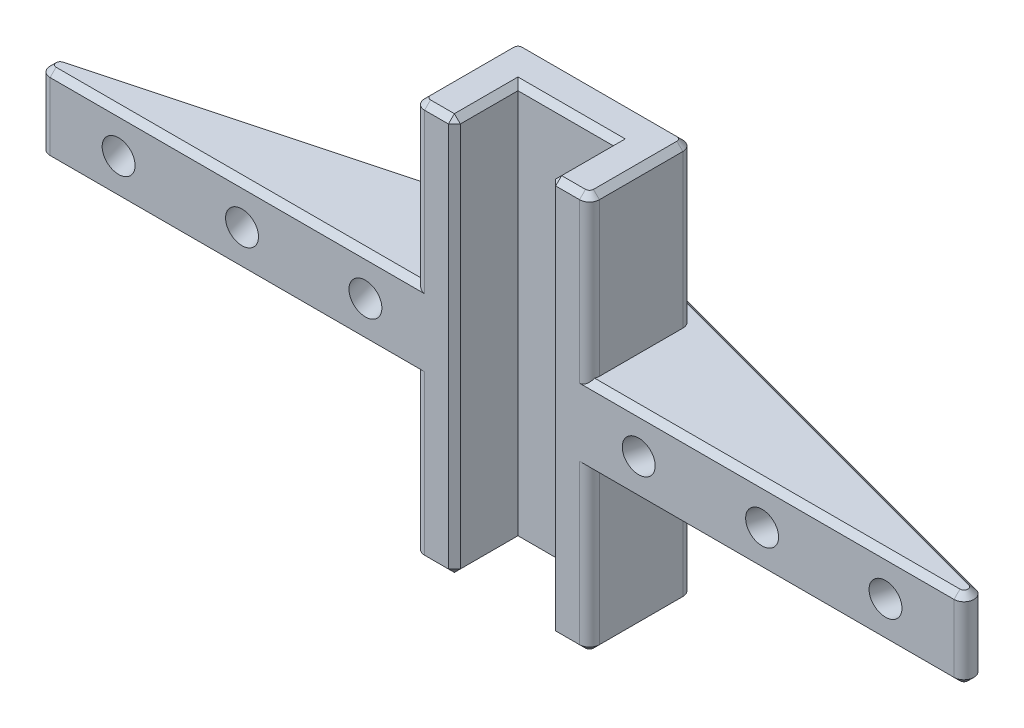
from build123d import *
from OCP.BRepFilletAPI import BRepFilletAPI_MakeChamfer

# Parameters (mm, degrees)
BOSS_EXTRUDE1_DEPTH            = 10
BOSS_EXTRUDE2_DEPTH            = 50
F_8_0MM_DOWEL_HOLE1_D          = 8
FILLET1_R                      = 2.5
CHAMFER1_SIZE                  = 1.5
CBORE_FOR_M5_SHCS1_D           = 5.5
CBORE_FOR_M5_SHCS1_CBORE_D     = 10
CBORE_FOR_M5_SHCS1_CBORE_DEPTH = 5
SKETCH9_R                      = 2.75
BOSS_EXTRUDE3_DEPTH            = 0.4
CHAMFER2_SIZE                  = 1
CHAMFER2_SIZE2                 = 1.732050808


with BuildPart() as part:
    # Sketch1 → Boss-Extrude1 (new, symmetric)
    with BuildSketch(Plane(origin=(0, 0, 0), x_dir=(1, 0, 0), z_dir=(0, 1, 0))):
        Polygon((12, 0), (-12, 0), (-12, -16), (-132.740728286, -16), (-12, 16.352380638), (12, 16.352380638), (132.740728286, -16), (12, -16), align=None)
    extrude(amount=BOSS_EXTRUDE1_DEPTH, both=True)

    # Sketch2 → Boss-Extrude2 (add, symmetric)
    with BuildSketch(Plane(origin=(0, 0, 0), x_dir=(1, 0, 0), z_dir=(0, 1, 0))):
        Polygon((-12, -16), (-12, 0), (12, 0), (12, -16), (22, -16), (22, 10), (-22, 10), (-22, -16), align=None)
    extrude(amount=BOSS_EXTRUDE2_DEPTH, both=True)

    # Ø8.0mm Dowel Hole1 (through all)
    with Locations(Plane(origin=(4.891942737, 0, -18.256978841), x_dir=(-0.96592582628907, 0, -0.2588190451025143), z_dir=(0.2588190451025143, 0, -0.96592582628907))):
        with Locations((-97.358802374, 0), (-67.358802374, 0), (-37.358802374, 0)):
            f_8_0mm_dowel_hole1 = Hole(F_8_0MM_DOWEL_HOLE1_D / 2)

    # Mirror1: Ø8.0mm Dowel Hole1 across plane
    add(f_8_0mm_dowel_hole1.mirror(Plane(origin=(0, 0, 0), x_dir=(0, 0, 1), z_dir=(1, 0, 0))), mode=Mode.SUBTRACT)

    # Fillet1
    fillet1_edges = [part.edges().sort_by_distance(p)[0] for p in [
        (-132.740728286, 0, 16),
        (-12, 0, -16.352380638),
        (12, 0, -16.352380638),
        (132.740728286, 0, 16),
        (-22, 30, 16),
        (22, 30, 16),
        (22, 30, -10),
        (-22, 30, -10),
        (-22, -30, 16),
        (22, -30, 16),
        (22, -30, -10),
        (-22, -30, -10),
    ]]
    fillet(fillet1_edges, radius=FILLET1_R)

    # Chamfer1
    chamfer1_edges = [part.edges().sort_by_distance(p)[0] for p in [
        (0, 10, -16.352380638),
        (-66.625671502, -10, 16),
        (-63.358153493, -10, -2.591004885),
        (63.358153493, -10, -2.591004885),
        (-116.229955158, -10, 13.826315481),
        (116.229955158, -10, 13.826315481),
        (-11.997184237, -10, -16.330992791),
        (11.997184237, -10, -16.330992791),
        (63.358153493, 10, -2.591004885),
        (-63.358153493, 10, -2.591004885),
        (-66.625671502, 10, 16),
        (-116.229955158, 10, 13.826315481),
        (116.229955158, 10, 13.826315481),
        (-11.997184237, 10, -16.330992791),
        (11.997184237, 10, -16.330992791),
        (-15.75, 50, 16),
        (-15.75, -50, 16),
        (-22, -50, 3),
        (0, -50, -10),
        (22, -50, 3),
        (-21.267766953, -50, -9.267766953),
        (21.267766953, -50, -9.267766953),
        (21.267766953, -50, 15.267766953),
        (-21.267766953, -50, 15.267766953),
        (-22, 50, 3),
        (22, 50, 3),
        (0, 50, -10),
        (-21.267766953, 50, -9.267766953),
        (21.267766953, 50, -9.267766953),
        (21.267766953, 50, 15.267766953),
        (-21.267766953, 50, 15.267766953),
        (-12, 0, 16),
        (12, 0, 16),
        (66.625671502, -10, 16),
        (66.625671502, 10, 16),
        (-12, -50, 8),
        (0, -50, 0),
        (12, -50, 8),
        (15.75, -50, 16),
        (-12, 50, 8),
        (0, 50, 0),
        (12, 50, 8),
        (15.75, 50, 16),
        (0, -10, -16.352380638),
    ]]
    chamfer(chamfer1_edges, length=CHAMFER1_SIZE)

    # CBORE for M5 SHCS1 (through all)
    with Locations(Plane(origin=(0, 0, -10), x_dir=(-1, 0, 0), z_dir=(0, 0, -1))):
        with Locations((0, 38), (0, -38)):
            CounterBoreHole(CBORE_FOR_M5_SHCS1_D / 2, CBORE_FOR_M5_SHCS1_CBORE_D / 2, CBORE_FOR_M5_SHCS1_CBORE_DEPTH)

    # Sketch9 → Boss-Extrude3 (add)
    with BuildSketch(Plane.XY):
        with Locations(Location((0, -38, 0), (0, 0, 180))):
            Circle(SKETCH9_R)
        with Locations(Location((0, 38, 0), (0, 0, 180))):
            Circle(SKETCH9_R)
    extrude(amount=-BOSS_EXTRUDE3_DEPTH)

    # Chamfer2: one chamfer whose edges measure the first distance from different faces: ONE call of the kernel's chamfer builder (chamfer() names one face for all edges)
    chamfer2_edges_1 = [part.edges().sort_by_distance(p)[0] for p in [
        (37.114071484, 0, -9.623085465),
        (66.091846273, 0, -1.858514112),
        (95.069621061, 0, 5.906057241),
    ]]
    chamfer2_side_1 = [part.faces().sort_by_distance(p)[0] for p in [
        (62.753662863, 0, -2.752977661),
    ]]
    chamfer2_edges_2 = [part.edges().sort_by_distance(p)[0] for p in [
        (-37.114071484, 0, -9.623085465),
        (-66.091846273, 0, -1.858514112),
        (-95.069621061, 0, 5.906057241),
    ]]
    chamfer2_side_2 = [part.faces().sort_by_distance(p)[0] for p in [
        (-62.753662863, 0, -2.752977661),
    ]]
    chamfer2 = BRepFilletAPI_MakeChamfer(part.part.solid().wrapped)
    for e in chamfer2_edges_1:
        chamfer2.Add(CHAMFER2_SIZE, CHAMFER2_SIZE2, e.wrapped, chamfer2_side_1[0].wrapped)  # the first distance lies on this face
    for e in chamfer2_edges_2:
        chamfer2.Add(CHAMFER2_SIZE, CHAMFER2_SIZE2, e.wrapped, chamfer2_side_2[0].wrapped)  # the first distance lies on this face
    add(Compound.cast(chamfer2.Shape()), mode=Mode.REPLACE)


solid = part.part
